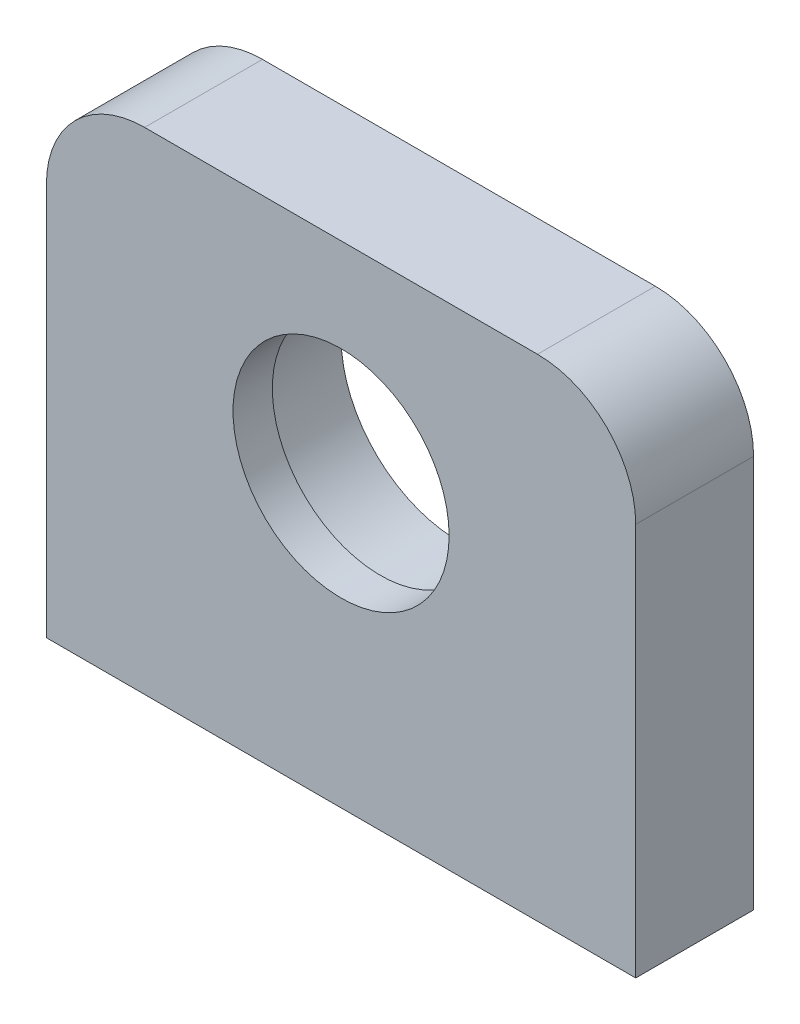
from build123d import *

# Parameters (mm, degrees)
SKETCH1_W           = 60
SKETCH1_H           = 50
BOSS_EXTRUDE1_DEPTH = 12
SKETCH2_R           = 11
CUT_EXTRUDE1_DEPTH  = 4
CUT_EXTRUDE5_REACH  = 41.862
SKETCH6_R           = 12
CUT_EXTRUDE7_DEPTH  = 8
CUT_EXTRUDE8_DEPTH  = 6.5
FILLET1_R           = 10


with BuildPart() as part:
    # Sketch1 → Boss-Extrude1 (new body)
    with BuildSketch(Plane.XY):
        Rectangle(SKETCH1_W, SKETCH1_H)
    extrude(amount=BOSS_EXTRUDE1_DEPTH)

    # Sketch2 → Cut-Extrude1 (cut)
    with BuildSketch(Plane.XY.offset(12)):
        with Locations((0, 4.5)):
            Circle(SKETCH2_R)
    extrude(amount=-CUT_EXTRUDE1_DEPTH, mode=Mode.SUBTRACT)

    # Sketch6 → Cut-Extrude5 (cut, up to next)
    with BuildSketch(Plane.XY.offset(8), mode=Mode.PRIVATE) as cut_extrude5_sk1:
        with Locations((0, 4.5)):
            Circle(SKETCH6_R)
    cut_extrude5_tool1 = extrude(cut_extrude5_sk1.sketch, amount=-CUT_EXTRUDE5_REACH, mode=Mode.PRIVATE) & part.part
    add(cut_extrude5_tool1.solids().sort_by_distance((0, 4.5, 8))[0], mode=Mode.SUBTRACT)

    # Sketch9 → Cut-Extrude7 (cut)
    with BuildSketch(Plane(origin=(33.355171667, 100.110949441, 0), x_dir=(-1, 0, 0), z_dir=(0, 0, -1))):
        with BuildLine():
            Line((9.355171667, -111.110949441), (17.355171667, -111.110949441))
            ThreePointArc((17.355171667, -111.110949441), (19.355171667, -113.110949441), (17.355171667, -115.110949441))
            Line((17.355171667, -115.110949441), (9.355171667, -115.110949441))
            ThreePointArc((9.355171667, -115.110949441), (7.355171667, -113.110949441), (9.355171667, -111.110949441))
        make_face()
    cut_extrude7 = extrude(amount=-CUT_EXTRUDE7_DEPTH, mode=Mode.SUBTRACT)

    # Sketch11 → Cut-Extrude8 (cut)
    with BuildSketch(Plane(origin=(33.355171667, 100.110949441, 0), x_dir=(-1, 0, 0), z_dir=(0, 0, -1))):
        with BuildLine():
            Line((15.855171667, -108.110949441), (15.855171667, -132.025405836))
            ThreePointArc((15.855171667, -132.025405836), (13.355171667, -134.525405836), (10.855171667, -132.025405836))
            Line((10.855171667, -132.025405836), (10.855171667, -108.110949441))
            ThreePointArc((10.855171667, -108.110949441), (13.355171667, -105.610949441), (15.855171667, -108.110949441))
        make_face()
    cut_extrude8 = extrude(amount=-CUT_EXTRUDE8_DEPTH, mode=Mode.SUBTRACT)

    # Mirror1: Cut-Extrude7, Cut-Extrude8 across plane
    add(cut_extrude7.mirror(Plane(origin=(0, 0, 0), x_dir=(0, 0, 1), z_dir=(1, 0, 0))), mode=Mode.SUBTRACT)
    add(cut_extrude8.mirror(Plane(origin=(0, 0, 0), x_dir=(0, 0, 1), z_dir=(1, 0, 0))), mode=Mode.SUBTRACT)

    # Fillet1
    fillet1_edges = [part.edges().sort_by_distance(p)[0] for p in [
        (-30, 25, 6),
        (30, 25, 6),
    ]]
    fillet(fillet1_edges, radius=FILLET1_R)


solid = part.part
